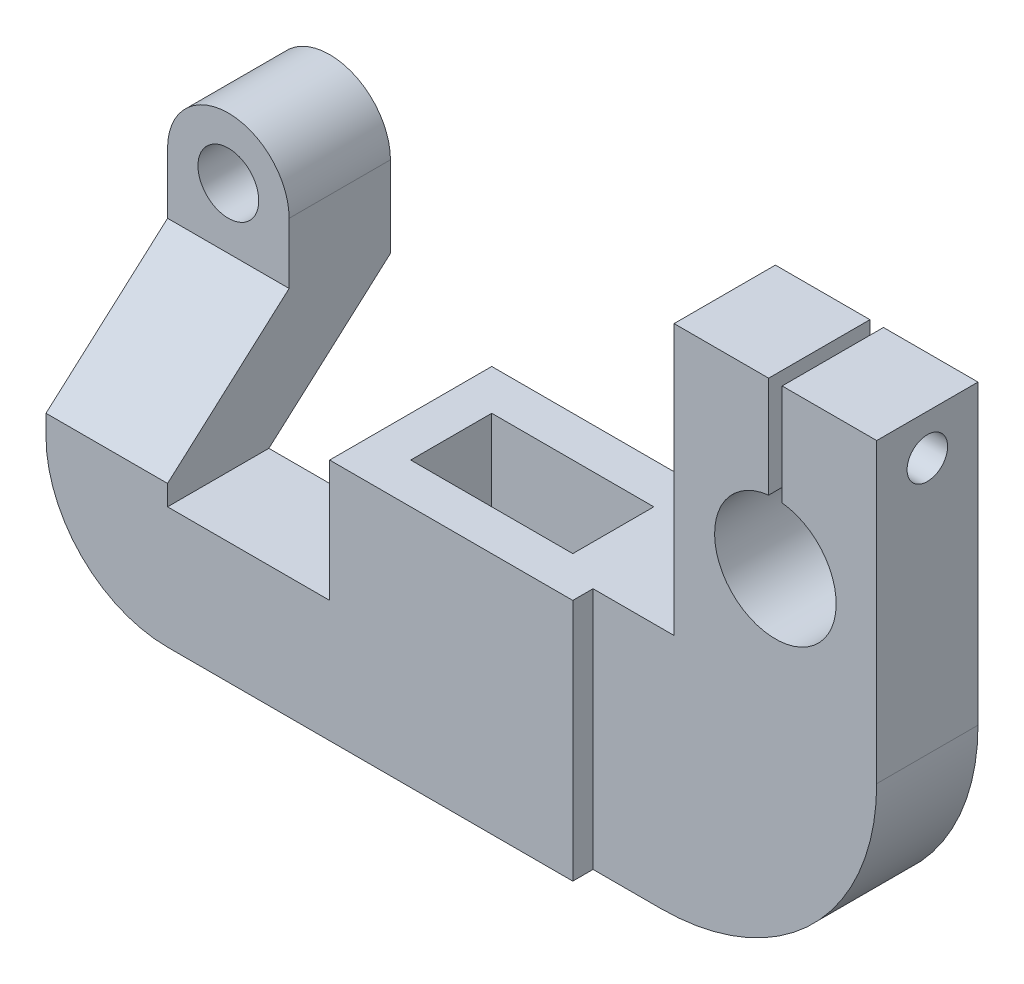
from build123d import *

# Parameters (mm, degrees)
SKETCH_1_R               = 4.5
EXTRUDE_2_DEPTH          = 33
CUT_EXTRUDE_3_DEPTH      = 42
SKETCH_6_W               = 24
SKETCH_6_H               = 12
CUT_EXTRUDE_4_DEPTH      = 85.587779831
CUT_EXTRUDE_5_DEPTH      = 85.587779831
CUT_EXTRUDE_5_DEPTH_BACK = 85.587779831
SKETCH_7_W               = 78
SKETCH_7_H               = 9
CUT_EXTRUDE_6_DEPTH      = 85.587779831
CUT_EXTRUDE_6_DEPTH_BACK = 85.587779831
SKETCH_8_W               = 42
SKETCH_8_H               = 6
SKETCH_8_H_2             = 3
CUT_EXTRUDE_7_DEPTH      = 105.787400596
CUT_EXTRUDE_7_DEPTH_BACK = 105.787400596
SKETCH_9_R               = 3


with BuildPart() as part:
    # 草图1 → 凸台-拉伸2 (new body)
    with BuildSketch(Plane.XY):
        with BuildLine():
            Line((52.828829832, 42.32492556), (52.828829832, 27.32492556))
            ThreePointArc((52.828829832, 27.32492556), (51.828829832, 9.38065365), (50.828829832, 27.32492556))
            Line((50.828829832, 27.32492556), (50.828829832, 42.32492556))
            Line((50.828829832, 42.32492556), (36.828829832, 42.32492556))
            Line((36.828829832, 42.32492556), (36.828829832, 2.32492556))
            Line((36.828829832, 2.32492556), (-11.171170168, 2.32492556))
            Line((-11.171170168, 2.32492556), (-11.171170168, -15.67507444))
            Line((-11.171170168, -15.67507444), (-35.171170168, -15.67507444))
            Line((-35.171170168, -15.67507444), (-35.171170168, 12.32492556))
            ThreePointArc((-35.171170168, 12.32492556), (-44.171170168, 21.32492556), (-53.171170168, 12.32492556))
            Line((-53.171170168, 12.32492556), (-53.171170168, -15.67507444))
            ThreePointArc((-53.171170168, -15.67507444), (-47.899092229, -28.402996501), (-35.171170168, -33.67507444))
            Line((-35.171170168, -33.67507444), (34.828829832, -33.67507444))
            ThreePointArc((34.828829832, -33.67507444), (57.45624683, -24.302491437), (66.828829832, -1.67507444))
            Line((66.828829832, -1.67507444), (66.828829832, 42.32492556))
            Line((66.828829832, 42.32492556), (52.828829832, 42.32492556))
        make_face()
        with Locations((-44.171170168, 12.32492556)):
            Circle(SKETCH_1_R, mode=Mode.SUBTRACT)
    extrude(amount=EXTRUDE_2_DEPTH)

    # 草图4 → 切除-拉伸3 (cut)
    with BuildSketch(Plane.ZY.offset(53.171170168)):
        Polygon((0, 0.32492556), (18, -15.67507444), (18, -33.67507444), (0, -33.67507444), align=None)
        Polygon((15, 21.32492556), (15, 3.32492556), (33, -12.67507444), (33, 21.32492556), align=None)
    extrude(amount=-CUT_EXTRUDE_3_DEPTH, mode=Mode.SUBTRACT)

    # 草图6 → 切除-拉伸4 (cut, through all)
    with BuildSketch(Plane(origin=(0, 2.32492556, 0), x_dir=(1, 0, 0), z_dir=(0, 1, 0))):
        with Locations((6.828829832, -21)):
            Rectangle(SKETCH_6_W, SKETCH_6_H)
    extrude(amount=-CUT_EXTRUDE_4_DEPTH, mode=Mode.SUBTRACT)

    # 草图7 → 切除-拉伸5 (cut, two sides: drawn at the far end of the back side and taken through both)
    with BuildSketch(Plane(origin=(0, 2.32492556, 0), x_dir=(1, 0, 0), z_dir=(0, 1, 0)).offset(-CUT_EXTRUDE_5_DEPTH_BACK)):
        with Locations((27.828829832, -4.5)):
            Rectangle(SKETCH_7_W, SKETCH_7_H)
    extrude(amount=CUT_EXTRUDE_5_DEPTH + CUT_EXTRUDE_5_DEPTH_BACK, mode=Mode.SUBTRACT)

    # 草图8 → 切除-拉伸6 (cut, two sides: drawn at the far end of the back side and taken through both)
    with BuildSketch(Plane(origin=(0, 2.32492556, 0), x_dir=(1, 0, 0), z_dir=(0, 1, 0)).offset(-CUT_EXTRUDE_6_DEPTH_BACK)):
        with Locations((45.828829832, -12)):
            Rectangle(SKETCH_8_W, SKETCH_8_H)
        with Locations((45.828829832, -31.5)):
            Rectangle(SKETCH_8_W, SKETCH_8_H_2)
    extrude(amount=CUT_EXTRUDE_6_DEPTH + CUT_EXTRUDE_6_DEPTH_BACK, mode=Mode.SUBTRACT)

    # 草图9 → 切除-拉伸7 (cut, two sides: drawn at the far end of the back side and taken through both)
    with BuildSketch(Plane.ZY.offset(-36.828829832).offset(-CUT_EXTRUDE_7_DEPTH_BACK)):
        with Locations(Location((22.5, 36.32492556, 0), (0, 0, 270))):
            Circle(SKETCH_9_R)
    extrude(amount=CUT_EXTRUDE_7_DEPTH + CUT_EXTRUDE_7_DEPTH_BACK, mode=Mode.SUBTRACT)


solid = part.part
